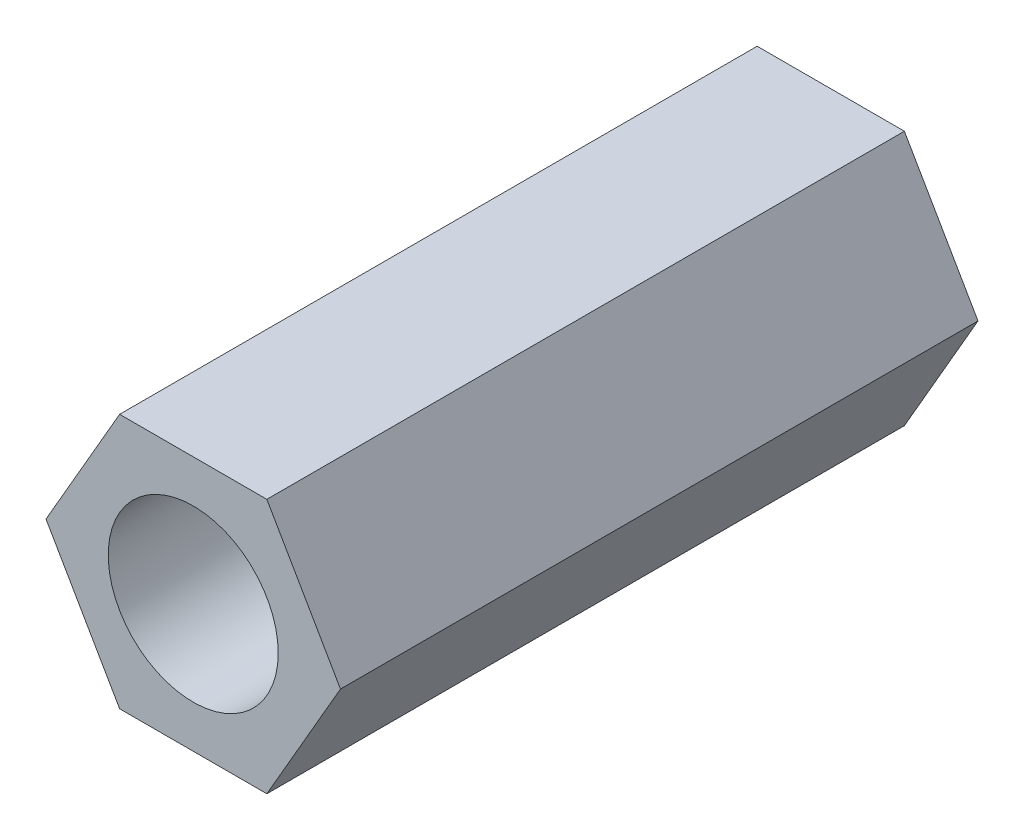
from build123d import *

# Parameters (mm, degrees)
ESQUISSE1_R        = 2
BOSS_EXTRU_1_DEPTH = 15


with BuildPart() as part:
    # Esquisse1 → Boss.-Extru.1 (new body)
    with BuildSketch(Plane.XY):
        Polygon((-3.464101615, 0), (-1.732050808, -3), (1.732050808, -3), (3.464101615, 0), (1.732050808, 3), (-1.732050808, 3), align=None)
        Circle(ESQUISSE1_R, mode=Mode.SUBTRACT)
    extrude(amount=BOSS_EXTRU_1_DEPTH)


solid = part.part
